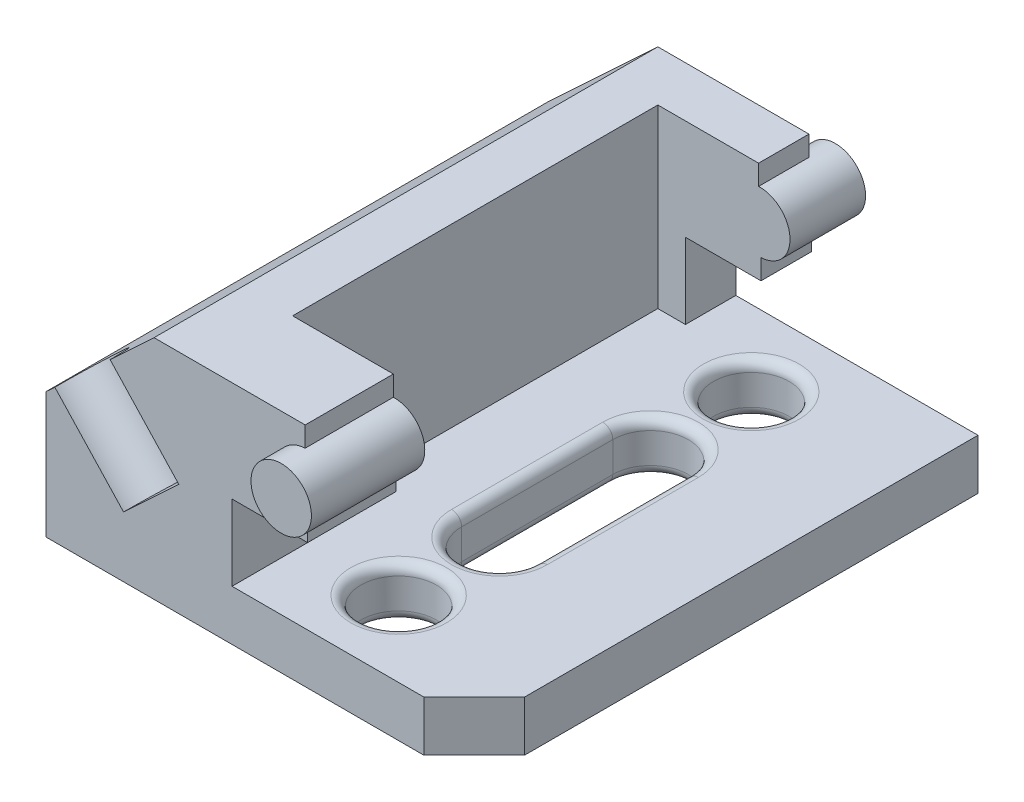
from build123d import *

# Parameters (mm, degrees)
ESQUISSE1_R             = 6
BOSS_EXTRU_1_DEPTH      = 110
ENL_V_MAT_EXTRU_1_DEPTH = 5
ENL_V_START             = -5
ENL_V_MAT_EXTRU_2_DEPTH = 5
ENL_V_MAT_EXTRU_4_REACH = 148.116
ESQUISSE5_W             = 37.986809269
ESQUISSE5_H             = 72.5
ESQUISSE6_R             = 7.5
ENL_V_MAT_EXTRU_5_DEPTH = 20
ESQUISSE7_R             = 7.5
ENL_V_MAT_EXTRU_6_DEPTH = 20
CONG_1_R                = 2
CONG_2_R                = 2


with BuildPart() as part:
    # Esquisse1 → Boss.-Extru.1 (new body)
    with BuildSketch(Plane.XY):
        with BuildLine():
            Line((-85, 0), (0, 0))
            Line((0, 0), (0, 10))
            Line((0, 10), (-48.072706324, 10))
            Line((-48.072706324, 10), (-48.072706324, 25.005758897))
            Line((-48.072706324, 25.005758897), (-33.072706324, 25.005758897))
            Line((-33.072706324, 25.005758897), (-33.072706324, 29.007679758))
            ThreePointArc((-33.072706324, 29.007679758), (-39.307865752, 34.762919711), (-33.5526258, 40.998079138))
            Line((-33.5526258, 40.998079138), (-33.5526258, 45))
            Line((-33.5526258, 45), (-63.5526258, 45))
            Line((-63.5526258, 45), (-85, 25))
            Line((-85, 25), (-85, 0))
        make_face()
        with Locations((-33.312666062, 35.002879448)):
            Circle(ESQUISSE1_R)
    extrude(amount=BOSS_EXTRU_1_DEPTH)

    # Esquisse2 → Enlèv. mat.-Extru.1 (cut)
    with BuildSketch(Plane(origin=(0, 0, 0), x_dir=(-1, 0, 0), z_dir=(0, 0, -1))):
        with BuildLine():
            Line((33.5526258, 45), (33.5526258, 40.998079138))
            ThreePointArc((33.5526258, 40.998079138), (39.307865752, 34.762919711), (33.072706324, 29.007679758))
            Line((33.072706324, 29.007679758), (33.072706324, 25.005758897))
            Line((33.072706324, 25.005758897), (48.072706324, 25.005758897))
            Line((48.072706324, 25.005758897), (48.072706324, 10))
            Line((48.072706324, 10), (0, 10))
            Line((0, 10), (0, 0))
            Line((0, 0), (85, 0))
            Line((85, 0), (85, 25))
            Line((85, 25), (63.5526258, 45))
            Line((63.5526258, 45), (33.5526258, 45))
        make_face()
    extrude(amount=-ENL_V_MAT_EXTRU_1_DEPTH, mode=Mode.SUBTRACT)

    # Esquisse3 → Enlèv. mat.-Extru.2 (cut)
    with BuildSketch(Plane.XY.offset(110).offset(ENL_V_START)):
        with BuildLine():
            Line((-33.5526258, 45), (-33.5526258, 40.998079138))
            ThreePointArc((-33.5526258, 40.998079138), (-39.307865752, 34.762919711), (-33.072706324, 29.007679758))
            Line((-33.072706324, 29.007679758), (-33.072706324, 25.005758897))
            Line((-33.072706324, 25.005758897), (-48.072706324, 25.005758897))
            Line((-48.072706324, 25.005758897), (-48.072706324, 10))
            Line((-48.072706324, 10), (0, 10))
            Line((0, 10), (0, 0))
            Line((0, 0), (-85, 0))
            Line((-85, 0), (-85, 25))
            Line((-85, 25), (-63.5526258, 45))
            Line((-63.5526258, 45), (-33.5526258, 45))
        make_face()
    extrude(amount=ENL_V_MAT_EXTRU_2_DEPTH, mode=Mode.SUBTRACT)

    # Enlèv. mat.-Extru.4: up to this face of the body (flat: up to its plane)
    enl_v_mat_extru_4_end = Plane(part.part.faces().sort_by_distance((-24.036353162, 10, 55))[0])
    # Esquisse5 → Enlèv. mat.-Extru.4 (cut, up to the picked face)
    with BuildSketch(Plane(origin=(0, 45, 0), x_dir=(1, 0, 0), z_dir=(0, 1, 0)), mode=Mode.PRIVATE) as enl_v_mat_extru_4_sk1:
        with Locations((-34.559221165, -51.25)):
            Rectangle(ESQUISSE5_W, ESQUISSE5_H)
    enl_v_mat_extru_4_tool1 = split(extrude(enl_v_mat_extru_4_sk1.sketch, amount=-ENL_V_MAT_EXTRU_4_REACH, mode=Mode.PRIVATE), bisect_by=enl_v_mat_extru_4_end, keep=Keep.BOTH, mode=Mode.PRIVATE)
    add(enl_v_mat_extru_4_tool1.solids().sort_by(Axis((-34.559221, 45, 51.25), (0, -1, 0)))[0], mode=Mode.SUBTRACT)

    # Esquisse6 → Enlèv. mat.-Extru.5 (cut)
    with BuildSketch(Plane(origin=(-52.004900494, 55.768428058, 0), x_dir=(0.7313537016191718, 0.6819983600624971, 0), z_dir=(-0.6819983600624971, 0.7313537016191718, 0))):
        with Locations((-35.214521923, -105)):
            Circle(ESQUISSE6_R)
    extrude(amount=-ENL_V_MAT_EXTRU_5_DEPTH, mode=Mode.SUBTRACT)

    # Esquisse7 → Enlèv. mat.-Extru.6 (cut)
    with BuildSketch(Plane(origin=(0, 10, 0), x_dir=(1, 0, 0), z_dir=(0, 1, 0))):
        with Locations(Location((-30, -20, 0), (0, 0, 270))):
            Circle(ESQUISSE7_R)
        with Locations(Location((-30, -90, 0), (0, 0, 270))):
            Circle(ESQUISSE7_R)
        with BuildLine():
            Line((-37.5, -40), (-37.5, -70))
            ThreePointArc((-37.5, -70), (-30, -77.5), (-22.5, -70))
            Line((-22.5, -70), (-22.5, -40))
            ThreePointArc((-22.5, -40), (-30, -32.5), (-37.5, -40))
        make_face()
        Polygon((-10, -105), (0, -95), (0, -105), align=None)
    extrude(amount=-ENL_V_MAT_EXTRU_6_DEPTH, mode=Mode.SUBTRACT)

    # Congé1
    cong_1_edges = [part.edges().sort_by_distance(p)[0] for p in [
        (-30, 10, 12.5),
        (-22.5, 10, 55),
        (-37.5, 10, 55),
        (-30, 10, 77.5),
        (-30, 10, 32.5),
        (-30, 10, 82.5),
    ]]
    fillet(cong_1_edges, radius=CONG_1_R)

    # Congé2
    cong_2_edges = [part.edges().sort_by_distance(p)[0] for p in [
        (-30, 0, 12.5),
        (-37.5, 0, 55),
        (-30, 0, 32.5),
        (-30, 0, 77.5),
        (-22.5, 0, 55),
        (-30, 0, 82.5),
    ]]
    fillet(cong_2_edges, radius=CONG_2_R)


solid = part.part
